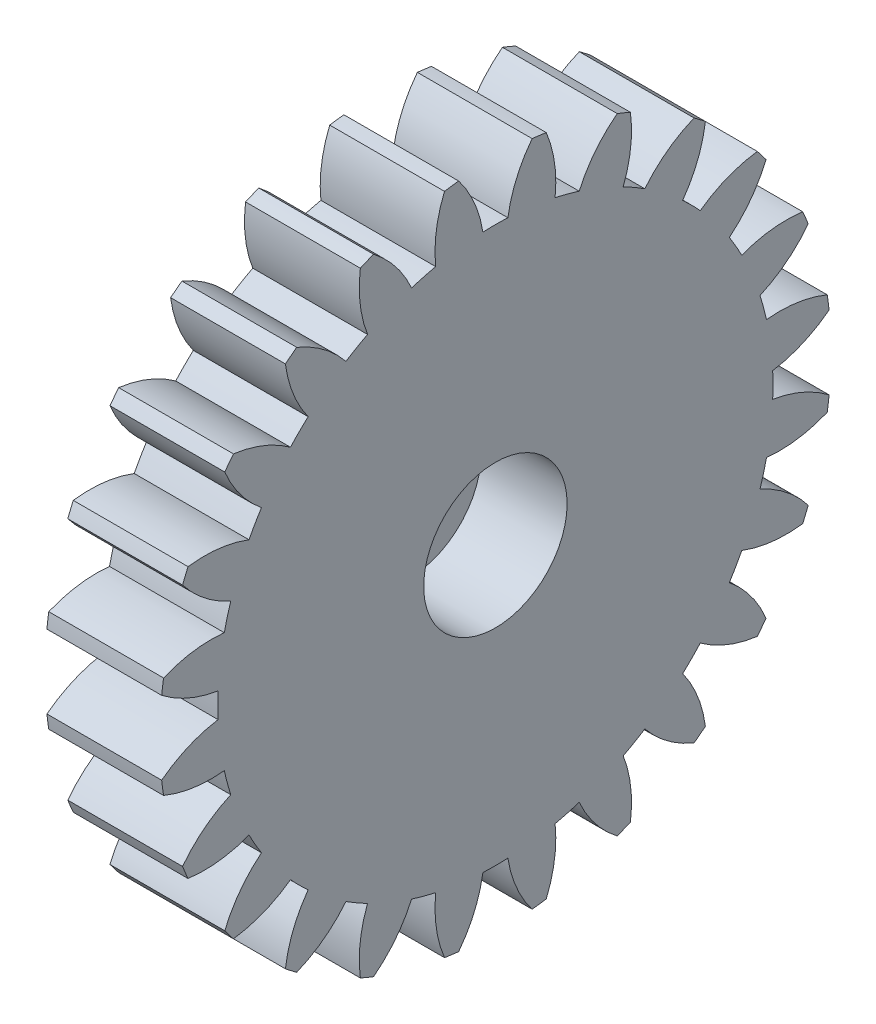
from build123d import *

# Parameters (mm, degrees)
BASPROSKE_W        = 4
BASPROSKE_H        = 11.7
TOOTHCUT_DEPTH     = 18.022925718
TEETHCUTS_COUNT    = 24
TEETHCUTS_ANGLE    = 345
BORSKE_R           = 1
BORE_DEPTH         = 50.0000508
SKETCH1_R          = 2.5
CUT_EXTRUDE1_DEPTH = 3


with BuildPart() as part:
    # BasProSke → Base-Revolve (revolve)
    with BuildSketch(Plane(origin=(0, 0, 0), x_dir=(1, 0, 0), z_dir=(0, 1, 0)), mode=Mode.PRIVATE) as base_revolve_sk:
        with Locations((2, 5.85)):
            Rectangle(BASPROSKE_W, BASPROSKE_H)
    revolve(base_revolve_sk.sketch.rotate(Axis((-10, 0, 0), (1, 0, 0)), 180), axis=Axis((-10, 0, 0), (1, 0, 0)))

    # TooCutSke → ToothCut (cut, through all)
    with BuildSketch(Plane(origin=(0, 0, 0), x_dir=(0, 0, -1), z_dir=(1, 0, 0))):
        with BuildLine():
            ThreePointArc((0.434774164, 9.664225133), (0, 9.674), (-0.434774164, 9.664225133))
            ThreePointArc((-0.434774164, 9.664225133), (-0.739698742, 10.71382507), (-1.298287656, 11.653302293))
            ThreePointArc((-1.298287656, 11.653302293), (0, 11.7254), (1.298287656, 11.653302293))
            ThreePointArc((1.298287656, 11.653302293), (0.739698742, 10.71382507), (0.434774164, 9.664225133))
        make_face()
    toothcut = extrude(amount=TOOTHCUT_DEPTH, mode=Mode.SUBTRACT)

    # TeethCuts: ToothCut ×24 about axis
    teethcuts_axis = Axis((-10, 0, 0), (1, 0, 0))
    for i in range(1, TEETHCUTS_COUNT):
        add(toothcut.rotate(teethcuts_axis, i * TEETHCUTS_ANGLE / (TEETHCUTS_COUNT - 1)), mode=Mode.SUBTRACT)

    # BorSke → Bore (cut, symmetric)
    with BuildSketch(Plane(origin=(0, 0, 0), x_dir=(0, 0, -1), z_dir=(1, 0, 0))):
        with Locations(Location((0, 0, 0), (0, 0, 180))):
            Circle(BORSKE_R)
    extrude(amount=BORE_DEPTH, both=True, mode=Mode.SUBTRACT)

    # Sketch1 → Cut-Extrude1 (cut)
    with BuildSketch(Plane(origin=(4, 0, 0), x_dir=(0, 0, -1), z_dir=(1, 0, 0))):
        Circle(SKETCH1_R)
    extrude(amount=-CUT_EXTRUDE1_DEPTH, mode=Mode.SUBTRACT)


solid = part.part
